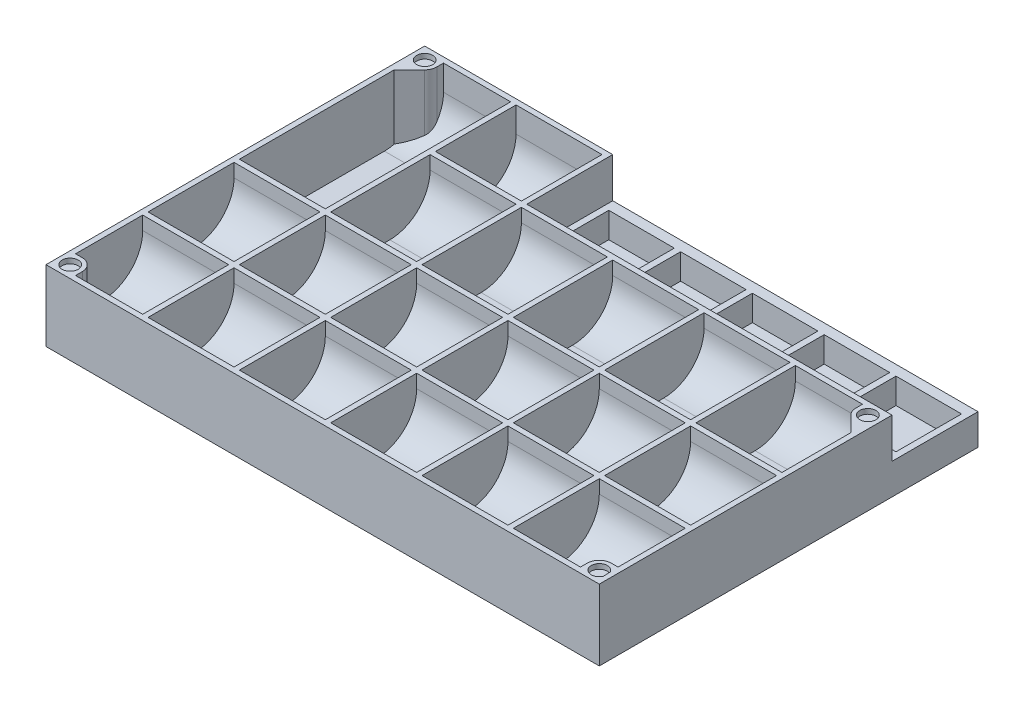
from build123d import *

# Parameters (mm, degrees)
SKETCH2_W            = 141
SKETCH2_H            = 26.4
BOSS_EXTRUDE2_DEPTH  = 2
BOSS_EXTRUDE3_DEPTH  = 34
BOSS_EXTRUDE5_START  = 32
BOSS_EXTRUDE5_DEPTH  = 32
BOSS_EXTRUDE6_START  = 32
SKETCH2_10_W         = 141
SKETCH2_10_H         = 26.4
BOSS_EXTRUDE6_DEPTH  = 2
BOSS_EXTRUDE7_START  = 66
BOSS_EXTRUDE7_DEPTH  = 32
BOSS_EXTRUDE8_START  = 66
SKETCH2_12_W         = 141
SKETCH2_12_H         = 26.4
BOSS_EXTRUDE8_DEPTH  = 2
BOSS_EXTRUDE9_START  = 100
BOSS_EXTRUDE9_DEPTH  = 32
BOSS_EXTRUDE10_START = 100
SKETCH2_14_W         = 141
SKETCH2_14_H         = 26.4
BOSS_EXTRUDE10_DEPTH = 2
BOSS_EXTRUDE11_START = 134
BOSS_EXTRUDE11_DEPTH = 32
BOSS_EXTRUDE12_START = 134
SKETCH2_17_W         = 141
SKETCH2_17_H         = 26.4
BOSS_EXTRUDE12_DEPTH = 2
BOSS_EXTRUDE13_START = -34
SKETCH2_18_W         = 141
SKETCH2_18_H         = 26.4
BOSS_EXTRUDE13_DEPTH = 2
BOSS_EXTRUDE14_START = 168
BOSS_EXTRUDE14_DEPTH = 32
BOSS_EXTRUDE15_START = 168
SKETCH2_20_W         = 141
SKETCH2_20_H         = 26.4
BOSS_EXTRUDE15_DEPTH = 2
BOSS_EXTRUDE16_DEPTH = 32
SKETCH4_W            = 136
SKETCH4_H            = 32
CUT_EXTRUDE1_DEPTH   = 14.9
SKETCH4_4_W          = 24.4
SKETCH4_4_H          = 24.4
CUT_EXTRUDE2_DEPTH   = 24.4
BOSS_EXTRUDE17_DEPTH = 24.4
SKETCH6_3_R          = 3
CUT_EXTRUDE3_DEPTH   = 1.85


with BuildPart() as part:
    # Sketch2 → Boss-Extrude2 (new body)
    with BuildSketch(Plane(origin=(0, 0, 0), x_dir=(0, 0, -1), z_dir=(1, 0, 0))):
        with Locations((70.5, 13.2)):
            Rectangle(SKETCH2_W, SKETCH2_H)
    extrude(amount=-BOSS_EXTRUDE2_DEPTH)

    # Sketch2<5> → Boss-Extrude3 (add)
    with BuildSketch(Plane(origin=(0, 0, 0), x_dir=(0, 0, -1), z_dir=(1, 0, 0))):
        with BuildLine():
            Line((0, 26.4), (0, 0))
            Line((0, 0), (70, 0))
            Line((70, 0), (70, 6.4))
            Line((70, 6.4), (70, 26.4))
            Line((70, 26.4), (68, 26.4))
            Line((68, 26.4), (68, 21.4))
            ThreePointArc((68, 21.4), (63.606601718, 10.793398282), (53, 6.4))
            Line((53, 6.4), (36, 6.4))
            Line((36, 6.4), (36, 26.4))
            Line((36, 26.4), (34, 26.4))
            Line((34, 26.4), (34, 21.4))
            ThreePointArc((34, 21.4), (29.606601718, 10.793398282), (19, 6.4))
            Line((19, 6.4), (2, 6.4))
            Line((2, 6.4), (2, 26.4))
            Line((2, 26.4), (0, 26.4))
        make_face()
    extrude(amount=-BOSS_EXTRUDE3_DEPTH)

    # Sketch2<9> → Boss-Extrude5 (add)
    with BuildSketch(Plane(origin=(0, 0, 0), x_dir=(0, 0, -1), z_dir=(1, 0, 0)).offset(BOSS_EXTRUDE5_START)):
        with BuildLine():
            Line((0, 26.4), (0, 0))
            Line((0, 0), (141, 0))
            Line((141, 0), (141, 26.4))
            Line((141, 26.4), (139, 26.4))
            Line((139, 26.4), (139, 17))
            ThreePointArc((139, 17), (134.606601718, 6.393398282), (124, 2))
            Line((124, 2), (109, 2))
            Line((109, 2), (109, 26.4))
            Line((109, 26.4), (107, 26.4))
            Line((107, 26.4), (107, 21.4))
            ThreePointArc((107, 21.4), (102.606601718, 10.793398282), (92, 6.4))
            Line((92, 6.4), (70, 6.4))
            Line((70, 6.4), (70, 26.4))
            Line((70, 26.4), (68, 26.4))
            Line((68, 26.4), (68, 21.4))
            ThreePointArc((68, 21.4), (63.606601718, 10.793398282), (53, 6.4))
            Line((53, 6.4), (36, 6.4))
            Line((36, 6.4), (36, 26.4))
            Line((36, 26.4), (34, 26.4))
            Line((34, 26.4), (34, 21.4))
            ThreePointArc((34, 21.4), (29.606601718, 10.793398282), (19, 6.4))
            Line((19, 6.4), (2, 6.4))
            Line((2, 6.4), (2, 26.4))
            Line((2, 26.4), (0, 26.4))
        make_face()
    extrude(amount=-BOSS_EXTRUDE5_DEPTH)

    # Sketch2<10> → Boss-Extrude6 (add)
    with BuildSketch(Plane(origin=(0, 0, 0), x_dir=(0, 0, -1), z_dir=(1, 0, 0)).offset(BOSS_EXTRUDE6_START)):
        with Locations((70.5, 13.2)):
            Rectangle(SKETCH2_10_W, SKETCH2_10_H)
    extrude(amount=BOSS_EXTRUDE6_DEPTH)

    # Sketch2<11> → Boss-Extrude7 (add)
    with BuildSketch(Plane(origin=(0, 0, 0), x_dir=(0, 0, -1), z_dir=(1, 0, 0)).offset(BOSS_EXTRUDE7_START)):
        with BuildLine():
            Line((0, 26.4), (0, 0))
            Line((0, 0), (141, 0))
            Line((141, 0), (141, 26.4))
            Line((141, 26.4), (107, 26.4))
            Line((107, 26.4), (107, 21.4))
            ThreePointArc((107, 21.4), (102.606601718, 10.793398282), (92, 6.4))
            Line((92, 6.4), (70, 6.4))
            Line((70, 6.4), (70, 26.4))
            Line((70, 26.4), (68, 26.4))
            Line((68, 26.4), (68, 21.4))
            ThreePointArc((68, 21.4), (63.606601718, 10.793398282), (53, 6.4))
            Line((53, 6.4), (36, 6.4))
            Line((36, 6.4), (36, 26.4))
            Line((36, 26.4), (34, 26.4))
            Line((34, 26.4), (34, 21.4))
            ThreePointArc((34, 21.4), (29.606601718, 10.793398282), (19, 6.4))
            Line((19, 6.4), (2, 6.4))
            Line((2, 6.4), (2, 26.4))
            Line((2, 26.4), (0, 26.4))
        make_face()
    extrude(amount=-BOSS_EXTRUDE7_DEPTH)

    # Sketch2<12> → Boss-Extrude8 (add)
    with BuildSketch(Plane(origin=(0, 0, 0), x_dir=(0, 0, -1), z_dir=(1, 0, 0)).offset(BOSS_EXTRUDE8_START)):
        with Locations((70.5, 13.2)):
            Rectangle(SKETCH2_12_W, SKETCH2_12_H)
    extrude(amount=BOSS_EXTRUDE8_DEPTH)

    # Sketch2<13> → Boss-Extrude9 (add)
    with BuildSketch(Plane(origin=(0, 0, 0), x_dir=(0, 0, -1), z_dir=(1, 0, 0)).offset(BOSS_EXTRUDE9_START)):
        with BuildLine():
            Line((0, 26.4), (0, 0))
            Line((0, 0), (141, 0))
            Line((141, 0), (141, 26.4))
            Line((141, 26.4), (107, 26.4))
            Line((107, 26.4), (107, 21.4))
            ThreePointArc((107, 21.4), (102.606601718, 10.793398282), (92, 6.4))
            Line((92, 6.4), (70, 6.4))
            Line((70, 6.4), (70, 26.4))
            Line((70, 26.4), (68, 26.4))
            Line((68, 26.4), (68, 21.4))
            ThreePointArc((68, 21.4), (63.606601718, 10.793398282), (53, 6.4))
            Line((53, 6.4), (36, 6.4))
            Line((36, 6.4), (36, 26.4))
            Line((36, 26.4), (34, 26.4))
            Line((34, 26.4), (34, 21.4))
            ThreePointArc((34, 21.4), (29.606601718, 10.793398282), (19, 6.4))
            Line((19, 6.4), (2, 6.4))
            Line((2, 6.4), (2, 26.4))
            Line((2, 26.4), (0, 26.4))
        make_face()
    extrude(amount=-BOSS_EXTRUDE9_DEPTH)

    # Sketch2<14> → Boss-Extrude10 (add)
    with BuildSketch(Plane(origin=(0, 0, 0), x_dir=(0, 0, -1), z_dir=(1, 0, 0)).offset(BOSS_EXTRUDE10_START)):
        with Locations((70.5, 13.2)):
            Rectangle(SKETCH2_14_W, SKETCH2_14_H)
    extrude(amount=BOSS_EXTRUDE10_DEPTH)

    # Sketch2<16> → Boss-Extrude11 (add)
    with BuildSketch(Plane(origin=(0, 0, 0), x_dir=(0, 0, -1), z_dir=(1, 0, 0)).offset(BOSS_EXTRUDE11_START)):
        with BuildLine():
            Line((0, 26.4), (0, 0))
            Line((0, 0), (141, 0))
            Line((141, 0), (141, 26.4))
            Line((141, 26.4), (107, 26.4))
            Line((107, 26.4), (107, 21.4))
            ThreePointArc((107, 21.4), (102.606601718, 10.793398282), (92, 6.4))
            Line((92, 6.4), (70, 6.4))
            Line((70, 6.4), (70, 26.4))
            Line((70, 26.4), (68, 26.4))
            Line((68, 26.4), (68, 21.4))
            ThreePointArc((68, 21.4), (63.606601718, 10.793398282), (53, 6.4))
            Line((53, 6.4), (36, 6.4))
            Line((36, 6.4), (36, 26.4))
            Line((36, 26.4), (34, 26.4))
            Line((34, 26.4), (34, 21.4))
            ThreePointArc((34, 21.4), (29.606601718, 10.793398282), (19, 6.4))
            Line((19, 6.4), (2, 6.4))
            Line((2, 6.4), (2, 26.4))
            Line((2, 26.4), (0, 26.4))
        make_face()
    extrude(amount=-BOSS_EXTRUDE11_DEPTH)

    # Sketch2<17> → Boss-Extrude12 (add)
    with BuildSketch(Plane(origin=(0, 0, 0), x_dir=(0, 0, -1), z_dir=(1, 0, 0)).offset(BOSS_EXTRUDE12_START)):
        with Locations((70.5, 13.2)):
            Rectangle(SKETCH2_17_W, SKETCH2_17_H)
    extrude(amount=BOSS_EXTRUDE12_DEPTH)

    # Sketch2<18> → Boss-Extrude13 (add)
    with BuildSketch(Plane(origin=(0, 0, 0), x_dir=(0, 0, -1), z_dir=(1, 0, 0)).offset(BOSS_EXTRUDE13_START)):
        with Locations((70.5, 13.2)):
            Rectangle(SKETCH2_18_W, SKETCH2_18_H)
    extrude(amount=-BOSS_EXTRUDE13_DEPTH)

    # Sketch2<19> → Boss-Extrude14 (add)
    with BuildSketch(Plane(origin=(0, 0, 0), x_dir=(0, 0, -1), z_dir=(1, 0, 0)).offset(BOSS_EXTRUDE14_START)):
        with BuildLine():
            Line((0, 26.4), (0, 0))
            Line((0, 0), (141, 0))
            Line((141, 0), (141, 26.4))
            Line((141, 26.4), (107, 26.4))
            Line((107, 26.4), (107, 21.4))
            ThreePointArc((107, 21.4), (102.606601718, 10.793398282), (92, 6.4))
            Line((92, 6.4), (70, 6.4))
            Line((70, 6.4), (70, 26.4))
            Line((70, 26.4), (68, 26.4))
            Line((68, 26.4), (68, 21.4))
            ThreePointArc((68, 21.4), (63.606601718, 10.793398282), (53, 6.4))
            Line((53, 6.4), (36, 6.4))
            Line((36, 6.4), (36, 26.4))
            Line((36, 26.4), (34, 26.4))
            Line((34, 26.4), (34, 21.4))
            ThreePointArc((34, 21.4), (29.606601718, 10.793398282), (19, 6.4))
            Line((19, 6.4), (2, 6.4))
            Line((2, 6.4), (2, 26.4))
            Line((2, 26.4), (0, 26.4))
        make_face()
    extrude(amount=-BOSS_EXTRUDE14_DEPTH)

    # Sketch2<20> → Boss-Extrude15 (add)
    with BuildSketch(Plane(origin=(0, 0, 0), x_dir=(0, 0, -1), z_dir=(1, 0, 0)).offset(BOSS_EXTRUDE15_START)):
        with Locations((70.5, 13.2)):
            Rectangle(SKETCH2_20_W, SKETCH2_20_H)
    extrude(amount=BOSS_EXTRUDE15_DEPTH)

    # Sketch3 → Boss-Extrude16 (add)
    with BuildSketch(Plane.ZY.offset(2)):
        with BuildLine():
            Line((-139, 26.4), (-141, 26.4))
            Line((-141, 26.4), (-141, 0))
            Line((-141, 0), (-70, 0))
            Line((-70, 0), (-70, 2))
            Line((-70, 2), (-124, 2))
            ThreePointArc((-124, 2), (-134.606601718, 6.393398282), (-139, 17))
            Line((-139, 17), (-139, 26.4))
        make_face()
    extrude(amount=BOSS_EXTRUDE16_DEPTH)

    # Sketch4 → Cut-Extrude1 (cut)
    with BuildSketch(Plane(origin=(0, 26.4, 0), x_dir=(1, 0, 0), z_dir=(0, 1, 0))):
        with Locations((102, 125)):
            Rectangle(SKETCH4_W, SKETCH4_H)
    extrude(amount=-CUT_EXTRUDE1_DEPTH, mode=Mode.SUBTRACT)

    # Sketch4<4> → Cut-Extrude2 (cut)
    with BuildSketch(Plane(origin=(0, 26.4, 0), x_dir=(1, 0, 0), z_dir=(0, 1, 0))):
        with Locations((48.533333333, 125)):
            Rectangle(SKETCH4_4_W, SKETCH4_4_H)
        with Locations((155.466666667, 125)):
            Rectangle(SKETCH4_4_W, SKETCH4_4_H)
        with Locations((75.266666667, 125)):
            Rectangle(SKETCH4_4_W, SKETCH4_4_H)
        with Locations((128.733333333, 125)):
            Rectangle(SKETCH4_4_W, SKETCH4_4_H)
        with Locations((102, 125)):
            Rectangle(SKETCH4_4_W, SKETCH4_4_H)
    extrude(amount=-CUT_EXTRUDE2_DEPTH, mode=Mode.SUBTRACT)

    # Sketch6 → Boss-Extrude17 (add)
    with BuildSketch(Plane(origin=(0, 26.4, 0), x_dir=(1, 0, 0), z_dir=(0, 1, 0))):
        with BuildLine():
            Line((-31.5, 9), (-34, 9))
            Line((-34, 9), (-35.602741995, 0.991621978))
            Line((-35.602741995, 0.991621978), (-27, 2))
            Line((-27, 2), (-27, 4.5))
            ThreePointArc((-27, 4.5), (-28.318019485, 7.681980515), (-31.5, 9))
        make_face()
        with BuildLine():
            Line((161, 4.5), (161, 2))
            Line((161, 2), (168.33949511, 0.968141779))
            Line((168.33949511, 0.968141779), (168, 9))
            Line((168, 9), (165.5, 9))
            ThreePointArc((165.5, 9), (162.318019485, 7.681980515), (161, 4.5))
        make_face()
        with BuildLine():
            Line((-27, 136.5), (-27, 139))
            Line((-27, 139), (-35.311287181, 140.168482284))
            Line((-35.311287181, 140.168482284), (-34, 127.636038969))
            Line((-34, 127.636038969), (-28.318019485, 133.318019485))
            ThreePointArc((-28.318019485, 133.318019485), (-27.342542104, 134.777924554), (-27, 136.5))
        make_face()
        with BuildLine():
            Line((169.466201364, 108.466201364), (161, 107))
            Line((161, 107), (161, 104.5))
            ThreePointArc((161, 104.5), (161.342542104, 102.777924554), (162.318019485, 101.318019485))
            Line((162.318019485, 101.318019485), (168, 95.636038969))
            Line((168, 95.636038969), (169.466201364, 108.466201364))
        make_face()
    extrude(amount=-BOSS_EXTRUDE17_DEPTH)

    # Sketch6<3> → Cut-Extrude3 (cut)
    with BuildSketch(Plane(origin=(0, 26.4, 0), x_dir=(1, 0, 0), z_dir=(0, 1, 0))):
        with BuildLine():
            ThreePointArc((168.129136039, 5.944868052), (162.502676361, 4.373307435), (168.241685355, 3.282148854))
            Line((168.241685355, 3.282148854), (168.129136039, 5.944868052))
        make_face()
        with Locations((-31.5, 4.5)):
            Circle(SKETCH6_3_R)
        with Locations((-31.5, 136.5)):
            Circle(SKETCH6_3_R)
        with Locations((165.5, 104.5)):
            Circle(SKETCH6_3_R)
    extrude(amount=-CUT_EXTRUDE3_DEPTH, mode=Mode.SUBTRACT)


solid = part.part
